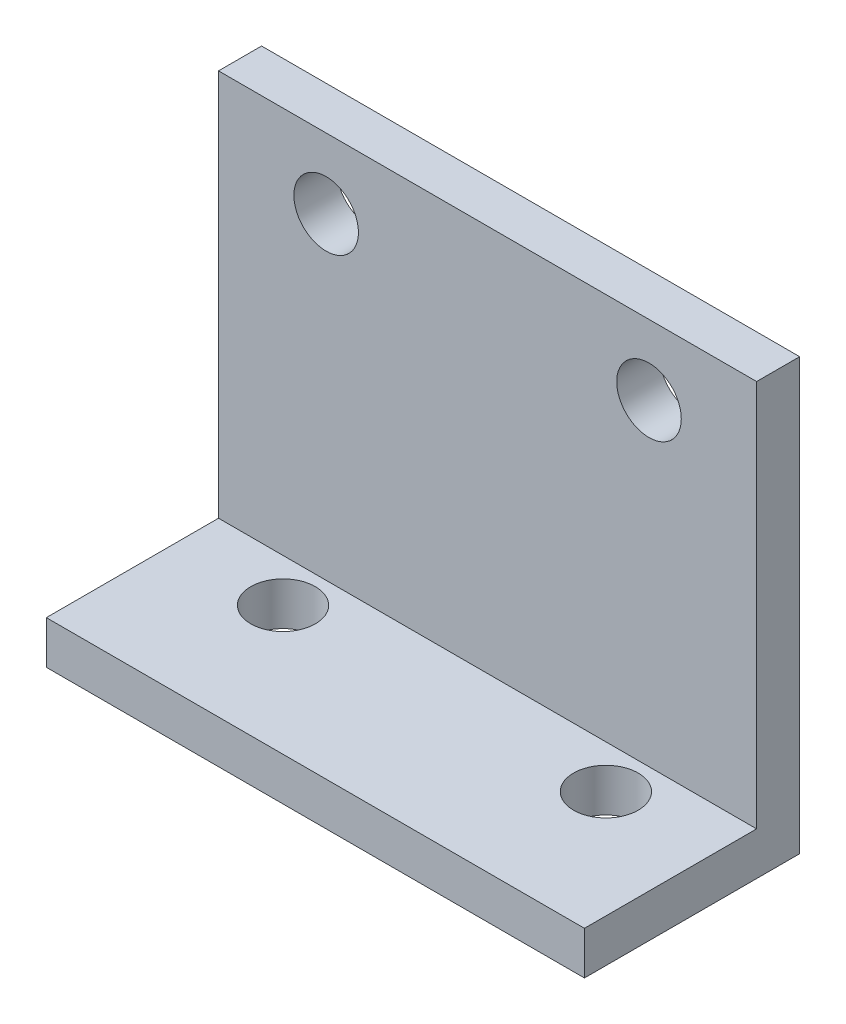
from build123d import *

# Parameters (mm, degrees)
SKETCH_1_W          = 25
SKETCH_1_H          = 2
EXTRUDE_1_DEPTH     = 20
EXTRUDE_2_DEPTH     = 2
SKETCH_2_R          = 1.5
CUT_EXTRUDE_1_DEPTH = 2


with BuildPart() as part:
    # 草图1 → 凸台-拉伸1 (new body)
    with BuildSketch(Plane(origin=(0, 0, 0), x_dir=(1, 0, 0), z_dir=(0, 1, 0))):
        with Locations((0, 4)):
            Rectangle(SKETCH_1_W, SKETCH_1_H)
    extrude(amount=EXTRUDE_1_DEPTH)

    # 草图1<3> → 凸台-拉伸2 (add)
    with BuildSketch(Plane(origin=(0, 0, 0), x_dir=(1, 0, 0), z_dir=(0, 1, 0))):
        Polygon((12.5, 3), (-12.5, 3), (-12.5, -5), (-7.5, -5), (0, -5), (7.5, -5), (12.5, -5), align=None)
        with BuildLine():
            ThreePointArc((-6, 0.997487313), (-6.439339828, -0.063172859), (-7.5, -0.502512687))
            ThreePointArc((-7.5, -0.502512687), (-8.560660172, 2.058147484), (-6, 0.997487313))
        make_face(mode=Mode.SUBTRACT)
        with BuildLine():
            ThreePointArc((9, 0.997487313), (7.5, -0.502512687), (6, 0.997487313))
            ThreePointArc((6, 0.997487313), (7.5, 2.497487313), (9, 0.997487313))
        make_face(mode=Mode.SUBTRACT)
    extrude(amount=EXTRUDE_2_DEPTH)

    # 草图2 → 切除-拉伸1 (cut)
    with BuildSketch(Plane.XY.offset(-3)):
        with Locations((7.5, 16.745611825)):
            Circle(SKETCH_2_R)
        with Locations((-7.5, 16.745611825)):
            Circle(SKETCH_2_R)
    extrude(amount=-CUT_EXTRUDE_1_DEPTH, mode=Mode.SUBTRACT)


solid = part.part
